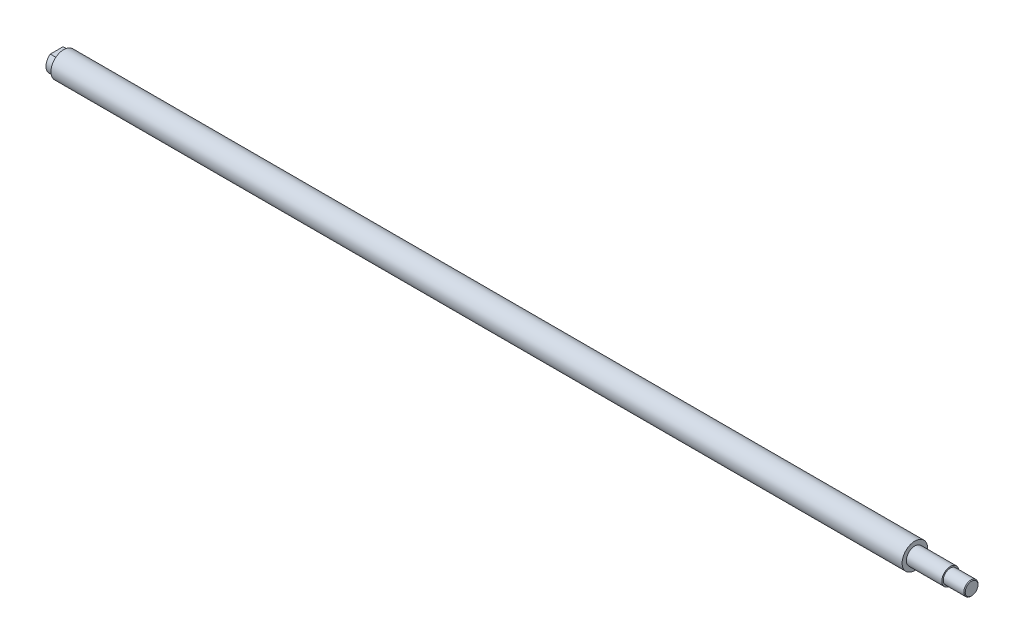
from build123d import *

# Parameters (mm, degrees)
CHAMFER1_SIZE       = 0.5
BOSS_EXTRUDE1_DEPTH = 5


with BuildPart() as part:
    # Sketch1 → Revolve1 (revolve)
    with BuildSketch(Plane.XY, mode=Mode.PRIVATE) as revolve1_sk:
        Polygon((0, 0), (-640, 0), (-640, 9), (-40, 9), (-40, 6), (-15, 6), (-15, 5), (0, 5), align=None)
    revolve(revolve1_sk.sketch.rotate(Axis((-640, 0, 0), (1, 0, 0)), 90), axis=Axis((-640, 0, 0), (1, 0, 0)))

    # Chamfer1
    chamfer1_edges = [part.edges().sort_by_distance(p)[0] for p in [
        (0, 0, -5),
    ]]
    chamfer(chamfer1_edges, length=CHAMFER1_SIZE)

    # Sketch2 → Boss-Extrude1 (add)
    with BuildSketch(Plane.ZY.offset(640)):
        with BuildLine():
            Line((-4.485716723, 6.010685941), (4.485716723, 6.010685941))
            ThreePointArc((4.485716723, 6.010685941), (0, -7.5), (-4.485716723, 6.010685941))
        make_face()
    extrude(amount=BOSS_EXTRUDE1_DEPTH)


solid = part.part
